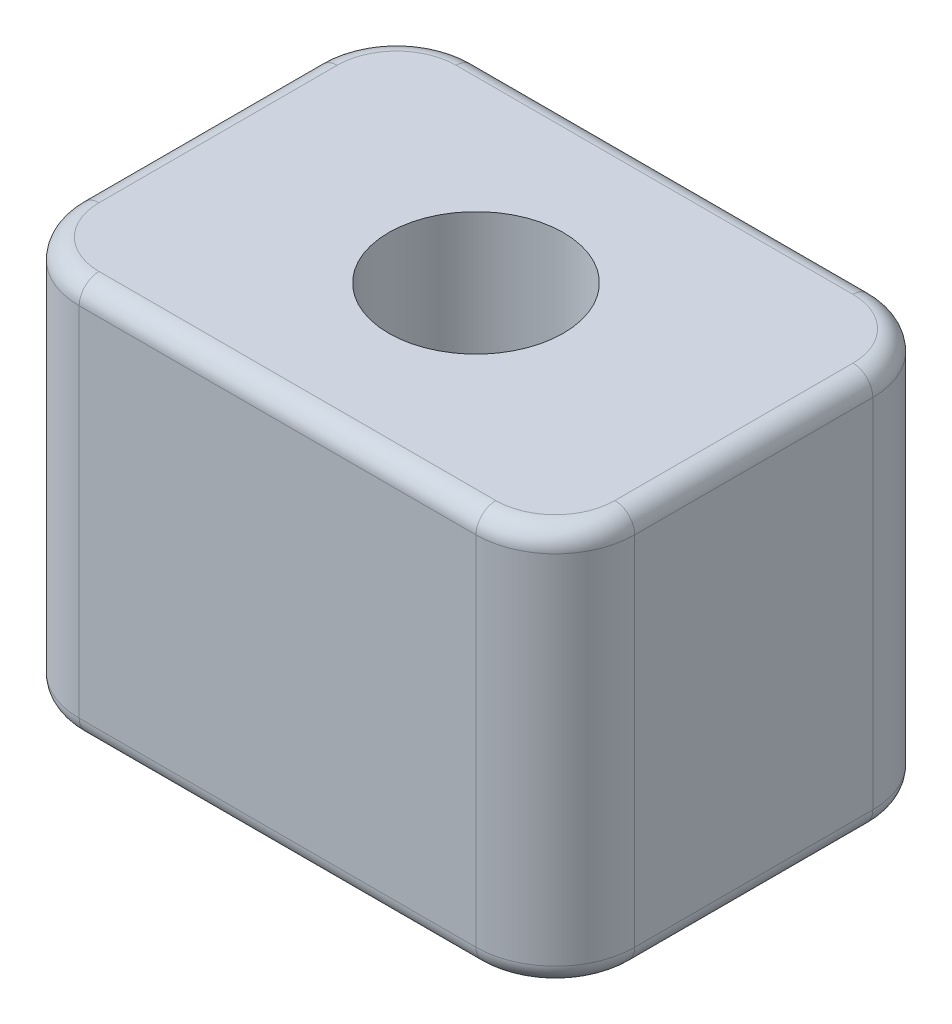
from build123d import *

# Parameters (mm, degrees)
SKETCH_1_W      = 7
SKETCH_1_H      = 5
SKETCH_1_R      = 1.1
EXTRUDE_1_DEPTH = 5
FILLET_2_R      = 1
FILLET_1_R      = 0.25


with BuildPart() as part:
    # 草图1 → 凸台-拉伸1 (new body)
    with BuildSketch(Plane(origin=(0, 0, 0), x_dir=(1, 0, 0), z_dir=(0, 1, 0))):
        Rectangle(SKETCH_1_W, SKETCH_1_H)
        with Locations(Location((0, 0, 0), (0, 0, 270))):
            Circle(SKETCH_1_R, mode=Mode.SUBTRACT)
    extrude(amount=EXTRUDE_1_DEPTH)

    # 圆角2
    fillet_2_edges = [part.edges().sort_by_distance(p)[0] for p in [
        (3.5, 2.5, 2.5),
        (-3.5, 2.5, 2.5),
        (-3.5, 2.5, -2.5),
        (3.5, 2.5, -2.5),
    ]]
    fillet(fillet_2_edges, radius=FILLET_2_R)

    # 圆角1
    fillet_1_edges = [part.edges().sort_by_distance(p)[0] for p in [
        (0, 0, -2.5),
        (0, 5, -2.5),
        (3.5, 0, 0),
        (0, 0, 2.5),
        (-3.5, 0, 0),
        (-3.207106781, 0, -2.207106781),
        (-3.207106781, 0, 2.207106781),
        (3.207106781, 0, 2.207106781),
        (3.207106781, 0, -2.207106781),
        (3.5, 5, 0),
        (-3.5, 5, 0),
        (0, 5, 2.5),
        (-3.207106781, 5, -2.207106781),
        (-3.207106781, 5, 2.207106781),
        (3.207106781, 5, 2.207106781),
        (3.207106781, 5, -2.207106781),
    ]]
    fillet(fillet_1_edges, radius=FILLET_1_R)


solid = part.part
